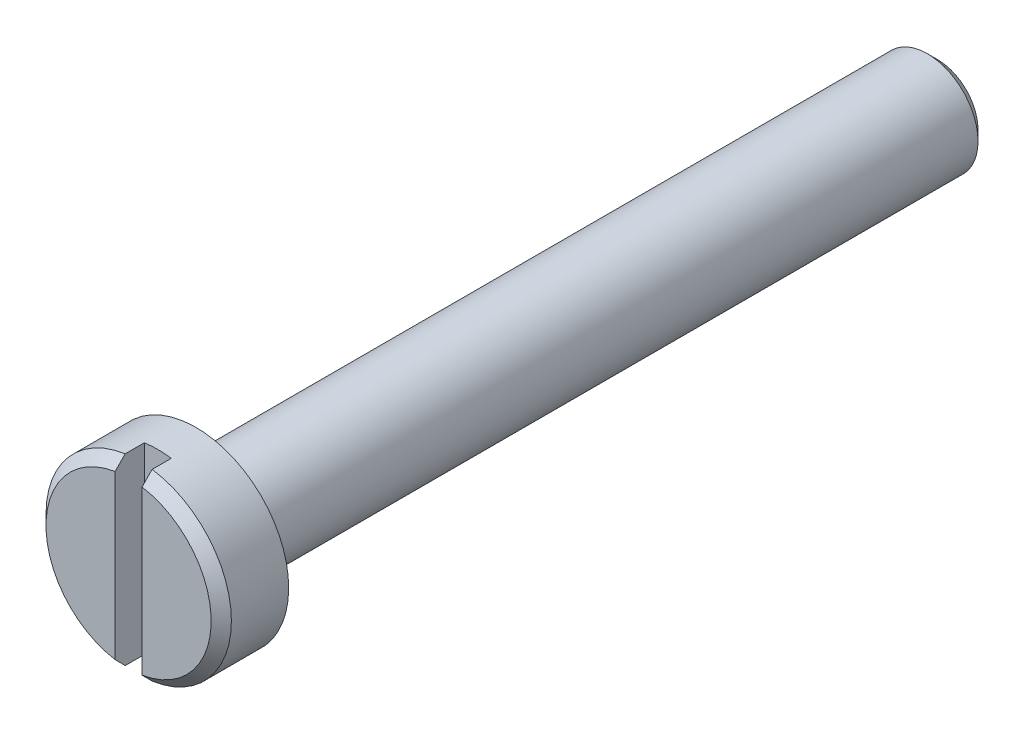
from build123d import *

# Parameters (mm, degrees)
SKETCH1_R               = 1.5
BOSS_EXTRUDE1_DEPTH     = 22
SKETCH2_R               = 2.75
BOSS_EXTRUDE2_DEPTH     = 2
CHAMFER1_SIZE           = 0.3
CUT_EXTRUDE1_DEPTH      = 23.341105613
CUT_EXTRUDE1_DEPTH_BACK = 23.341105613
SKETCH3_W               = 0.8
SKETCH3_H               = 1.7


with BuildPart() as part:
    # Sketch1 → Boss-Extrude1 (new body)
    with BuildSketch(Plane.XY):
        Circle(SKETCH1_R)
    extrude(amount=-BOSS_EXTRUDE1_DEPTH)

    # Sketch2 → Boss-Extrude2 (add)
    with BuildSketch(Plane.XY):
        Circle(SKETCH2_R)
    extrude(amount=BOSS_EXTRUDE2_DEPTH)

    # Chamfer1
    chamfer1_edges = [part.edges().sort_by_distance(p)[0] for p in [
        (-1.5, 0, -22),
        (-2.75, 0, 2),
    ]]
    chamfer(chamfer1_edges, length=CHAMFER1_SIZE)

    # Sketch3 → Cut-Extrude1 (cut, two sides: drawn at the far end of the back side and taken through both)
    with BuildSketch(Plane(origin=(0, 0, 0), x_dir=(1, 0, 0), z_dir=(0, 1, 0)).offset(-CUT_EXTRUDE1_DEPTH_BACK)):
        with Locations((0, -1.982738086)):
            Rectangle(SKETCH3_W, SKETCH3_H)
    extrude(amount=CUT_EXTRUDE1_DEPTH + CUT_EXTRUDE1_DEPTH_BACK, mode=Mode.SUBTRACT)


solid = part.part
